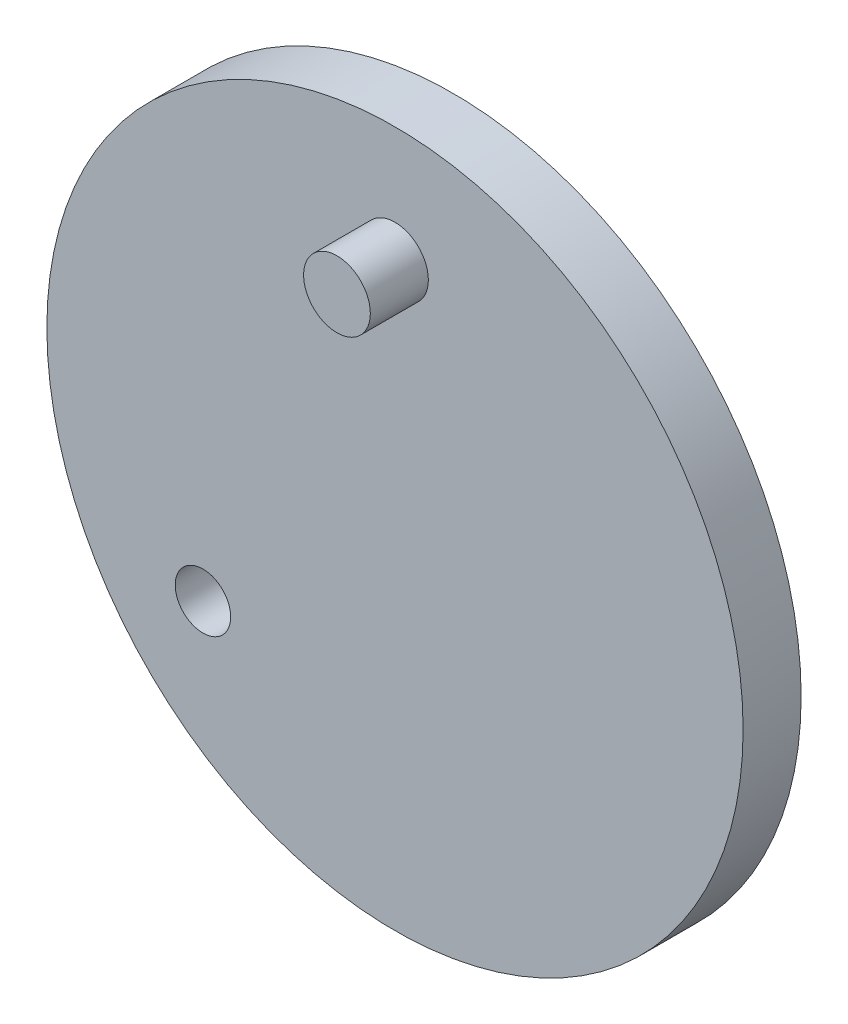
from build123d import *

# Parameters (mm, degrees)
SKETCH1_R           = 30
BOSS_EXTRUDE1_DEPTH = 5
SKETCH2_R           = 2.875
BOSS_EXTRUDE2_DEPTH = 5
SKETCH3_R           = 2.390739662
CUT_EXTRUDE1_DEPTH  = 10


with BuildPart() as part:
    # Sketch1 → Boss-Extrude1 (new body)
    with BuildSketch(Plane.XY):
        Circle(SKETCH1_R)
    extrude(amount=BOSS_EXTRUDE1_DEPTH)

    # Sketch2 → Boss-Extrude2 (add)
    with BuildSketch(Plane.XY.offset(5)):
        with Locations((0, 20)):
            Circle(SKETCH2_R)
    extrude(amount=BOSS_EXTRUDE2_DEPTH)

    # Sketch3 → Cut-Extrude1 (cut)
    with BuildSketch(Plane.XY.offset(5)):
        with Locations((-16.548801548, -13.666947255)):
            Circle(SKETCH3_R)
    extrude(amount=-CUT_EXTRUDE1_DEPTH, mode=Mode.SUBTRACT)


solid = part.part
